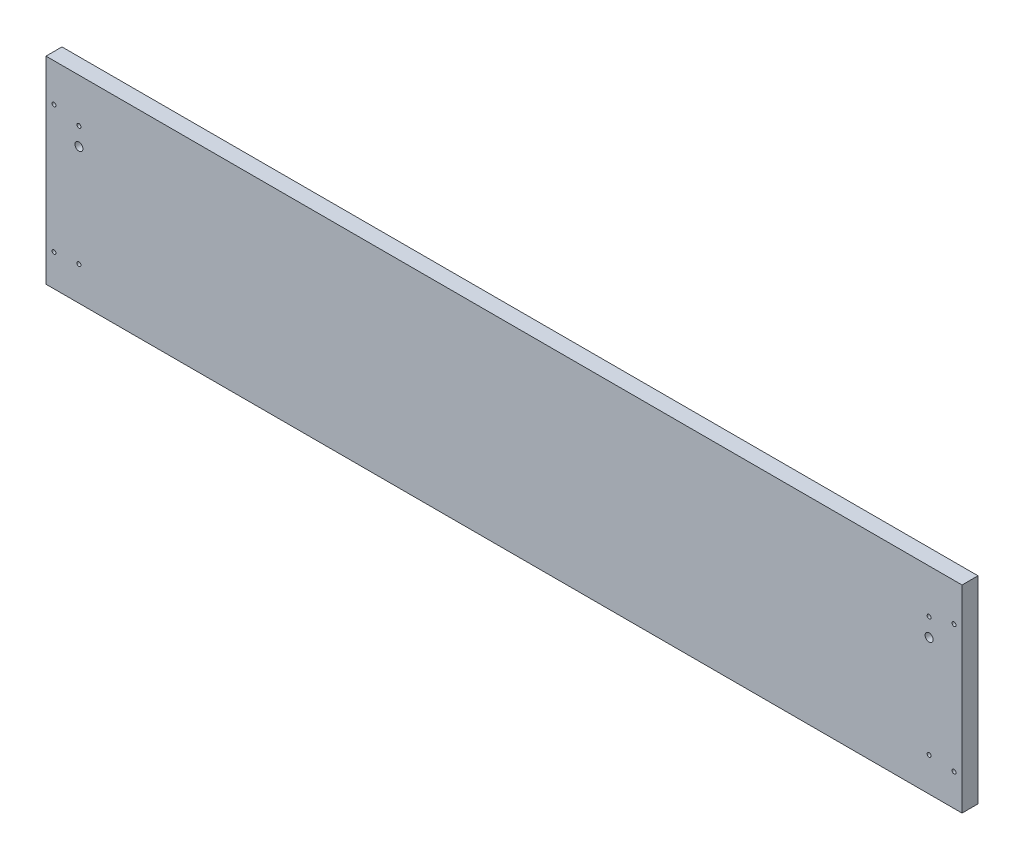
from build123d import *

# Parameters (mm, degrees)
SKETCH2_W          = 728.6625
SKETCH2_H          = 157.1625
EXTRUDE1_DEPTH     = 12.7
SKETCH3_R          = 3.175
SKETCH3_R_2        = 1.5875
CUT_EXTRUDE1_DEPTH = 12.7


with BuildPart() as part:
    # Sketch2 → Extrude1 (new body)
    with BuildSketch(Plane.XY):
        with Locations((-5376.06875, 1285.08125)):
            Rectangle(SKETCH2_W, SKETCH2_H)
    extrude(amount=-EXTRUDE1_DEPTH)

    # Sketch3 → Cut-Extrude1 (cut)
    with BuildSketch(Plane.XY):
        with Locations((-5714.20625, 1314.45)):
            Circle(SKETCH3_R)
        with Locations((-5714.20625, 1328.7375)):
            Circle(SKETCH3_R_2)
        with Locations((-5734.05, 1333.5)):
            Circle(SKETCH3_R_2)
        with Locations((-5734.05, 1231.9)):
            Circle(SKETCH3_R_2)
        with Locations((-5714.20625, 1233.4875)):
            Circle(SKETCH3_R_2)
        with Locations((-5037.93125, 1314.45)):
            Circle(SKETCH3_R)
        with Locations((-5037.93125, 1328.7375)):
            Circle(SKETCH3_R_2)
        with Locations((-5018.0875, 1333.5)):
            Circle(SKETCH3_R_2)
        with Locations((-5037.93125, 1233.4875)):
            Circle(SKETCH3_R_2)
        with Locations((-5018.0875, 1231.9)):
            Circle(SKETCH3_R_2)
    extrude(amount=-CUT_EXTRUDE1_DEPTH, mode=Mode.SUBTRACT)


solid = part.part
